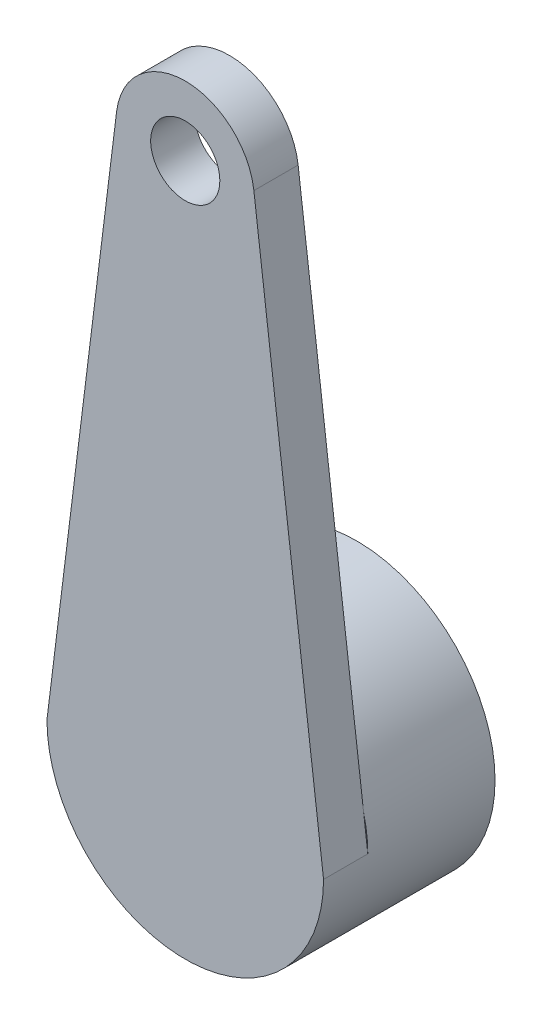
from build123d import *

# Parameters (mm, degrees)
SKETCH1_R           = 6.35
SKETCH1_R_2         = 4.064
BOSS_EXTRUDE1_DEPTH = 5.842
SKETCH2_R           = 1.5875
BOSS_EXTRUDE2_DEPTH = 2.032


with BuildPart() as part:
    # Sketch1 → Boss-Extrude1 (new body)
    with BuildSketch(Plane.XY):
        with Locations((6780.775840345, 3542.568139787)):
            Circle(SKETCH1_R)
        with Locations((6780.775840345, 3542.568139787)):
            Circle(SKETCH1_R_2, mode=Mode.SUBTRACT)
    extrude(amount=BOSS_EXTRUDE1_DEPTH)

    # Sketch2 → Boss-Extrude2 (add)
    with BuildSketch(Plane.XY.offset(5.842)):
        with BuildLine():
            Line((6774.425840345, 3542.568139787), (6777.624987986, 3568.358977876))
            ThreePointArc((6777.624987986, 3568.358977876), (6780.775840345, 3571.143139787), (6783.926692704, 3568.358977876))
            Line((6783.926692704, 3568.358977876), (6787.125840345, 3542.568139787))
            ThreePointArc((6787.125840345, 3542.568139787), (6780.775840345, 3536.218139787), (6774.425840345, 3542.568139787))
        make_face()
        with Locations((6780.775840345, 3567.968139787)):
            Circle(SKETCH2_R, mode=Mode.SUBTRACT)
    extrude(amount=BOSS_EXTRUDE2_DEPTH)


solid = part.part
